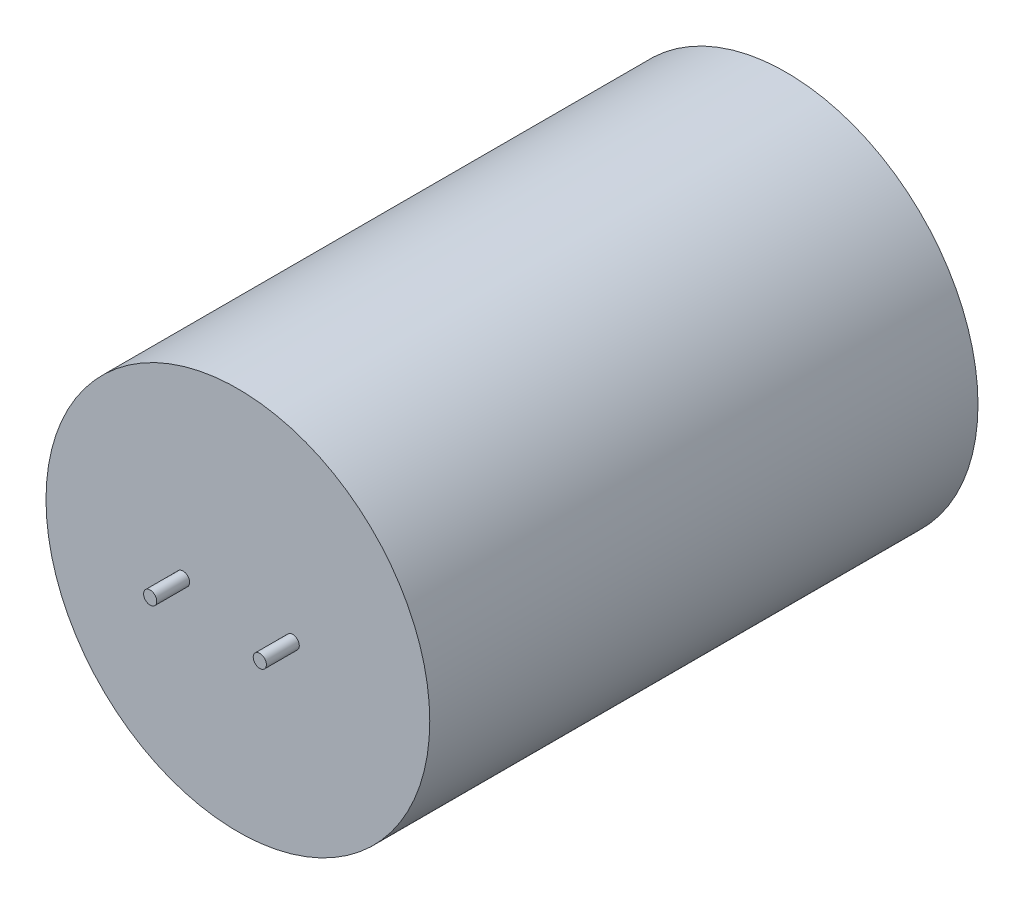
from build123d import *

# Parameters (mm, degrees)
SKETCH_1_R      = 17.5
EXTRUDE_1_DEPTH = 50
SKETCH_2_R      = 0.6
EXTRUDE_2_DEPTH = 3


with BuildPart() as part:
    # Эскиз1 → Вытянуть1 (new body)
    with BuildSketch(Plane.XY):
        Circle(SKETCH_1_R)
    extrude(amount=EXTRUDE_1_DEPTH)

    # Эскиз2 → Вытянуть2 (add)
    with BuildSketch(Plane.XY.offset(50)):
        with Locations((-5, 0)):
            Circle(SKETCH_2_R)
        with Locations((5, 0)):
            Circle(SKETCH_2_R)
    extrude(amount=EXTRUDE_2_DEPTH)


solid = part.part
